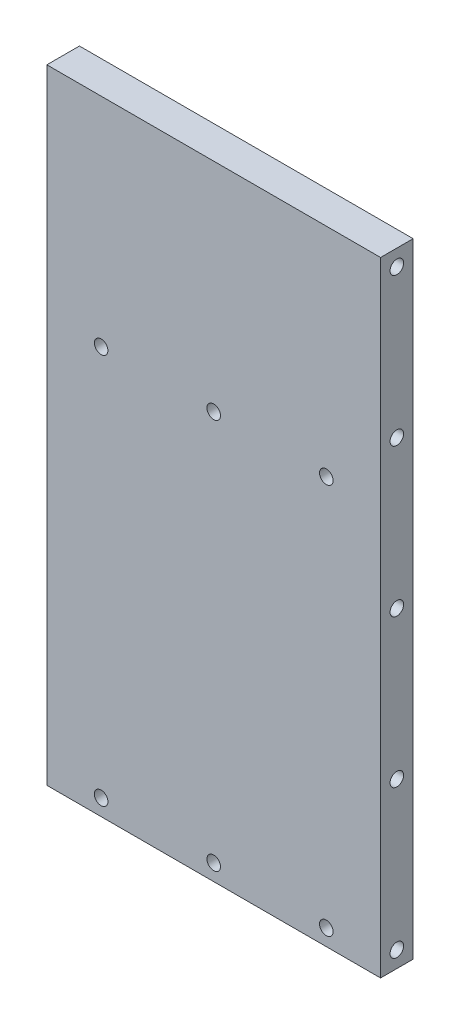
from build123d import *

# Parameters (mm, degrees)
SKETCH_1_W           = 61.5
SKETCH_1_H           = 115
EXTRUDE_1_DEPTH      = 3
M3X0_5_1_D           = 2.5
M3X0_5_1_ON_FACE_2_D = 2.5
M3X0_5_1_ON_FACE_3_D = 2.5


with BuildPart() as part:
    # ｽｹｯﾁ1 → ﾎﾞｽ - 押し出し1 (new, symmetric)
    with BuildSketch(Plane.XY):
        Rectangle(SKETCH_1_W, SKETCH_1_H)
    extrude(amount=EXTRUDE_1_DEPTH, both=True)

    # M3x0.5 ねじ穴1 (through all)
    with Locations(Plane(origin=(-20.75, 17.5, 3), x_dir=(1, 0, 0), z_dir=(0, 0, 1))):
        with Locations((0, 0), (20.75, 0), (41.5, 0), (41.5, -72), (20.75, -72), (0, -72)):
            Hole(M3X0_5_1_D / 2)

    # M3x0.5 ねじ穴1 on face 2 (through all)
    with Locations(Plane(origin=(30.75, 54.5, 0), x_dir=(0, 0, 1), z_dir=(1, 0, 0))):
        with Locations((0, 0), (0, 27.25), (0, 54.5), (0, 81.75), (0, 109)):
            Hole(M3X0_5_1_ON_FACE_2_D / 2)

    # M3x0.5 ねじ穴1 on face 3 (through all)
    with Locations(Plane(origin=(-30.75, -54.5, 0), x_dir=(0, 0, -1), z_dir=(-1, 0, 0))):
        with Locations((0, 0), (0, -27.25), (0, -54.5), (0, -81.75), (0, -109)):
            Hole(M3X0_5_1_ON_FACE_3_D / 2)


solid = part.part
